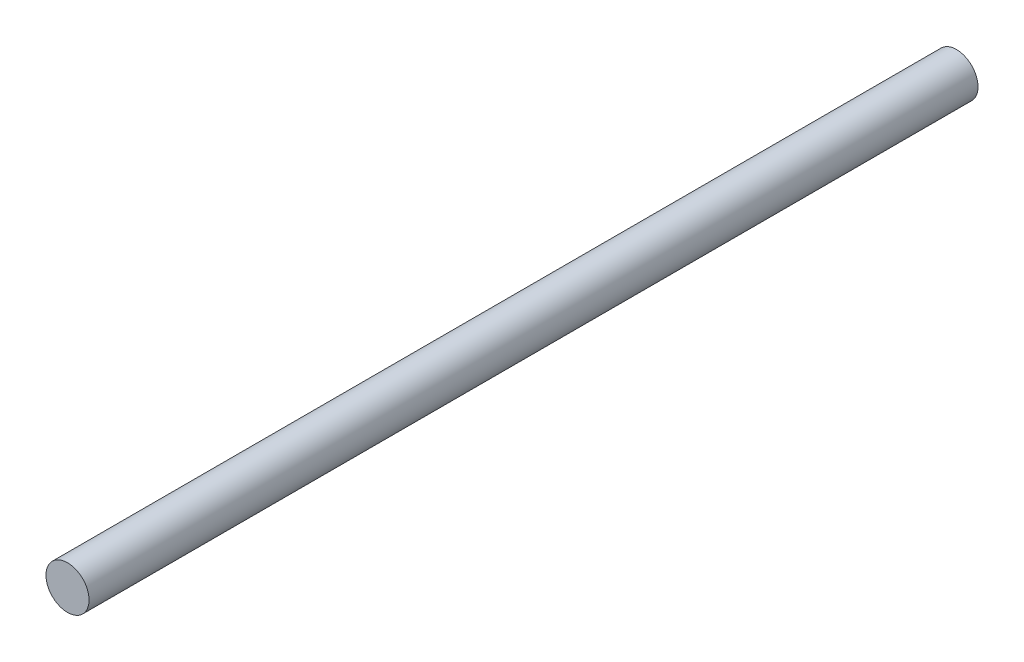
from build123d import *

# Parameters (mm, degrees)
CROQUIS1_R              = 4
SALIENTE_EXTRUIR1_DEPTH = 165


with BuildPart() as part:
    # Croquis1 → Saliente-Extruir1 (new body)
    with BuildSketch(Plane.XY):
        Circle(CROQUIS1_R)
    extrude(amount=SALIENTE_EXTRUIR1_DEPTH)


solid = part.part
